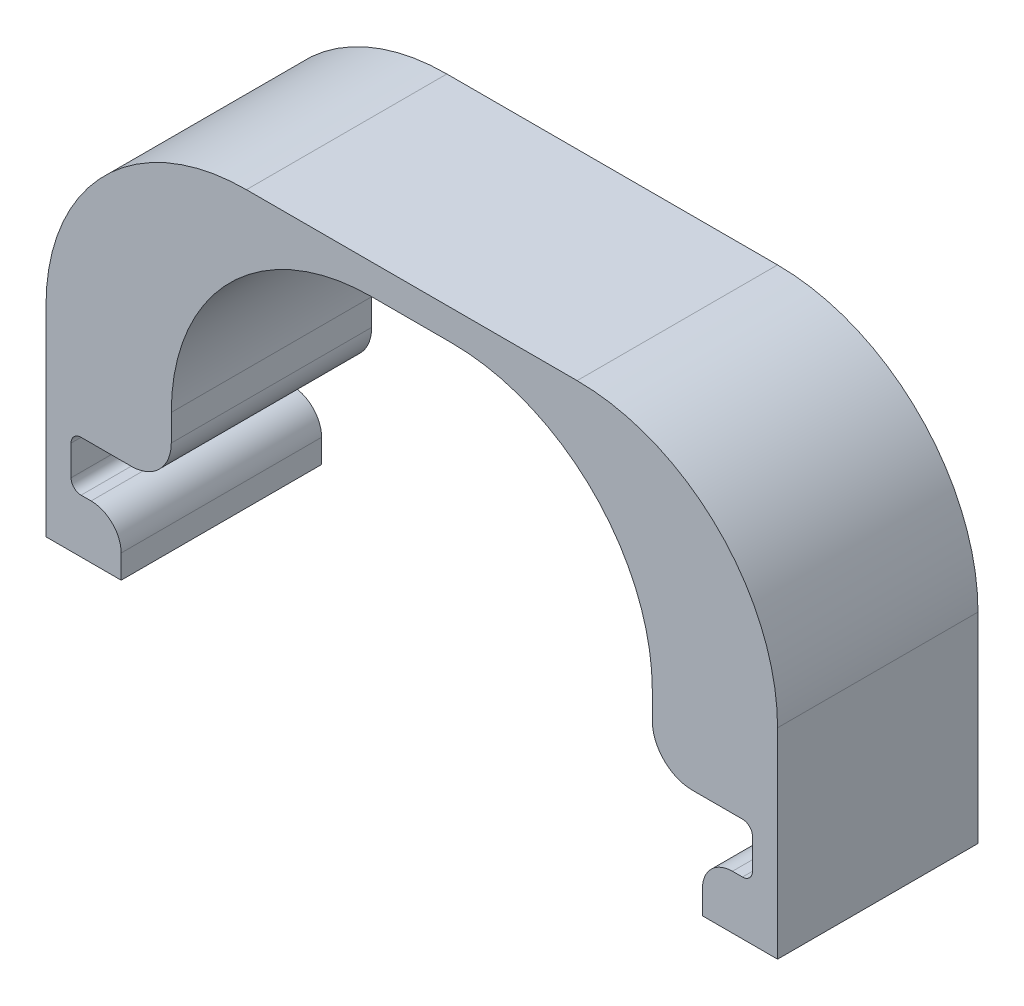
from build123d import *

# Parameters (mm, degrees)
SKETCH1_W           = 73
SKETCH1_H           = 20
BOSS_EXTRUDE1_DEPTH = 40
CUT_EXTRUDE1_DEPTH  = 20
FILLET1_R           = 20
FILLET2_R           = 20


with BuildPart() as part:
    # Sketch1 → Boss-Extrude1 (new body)
    with BuildSketch(Plane(origin=(0, 0, 0), x_dir=(1, 0, 0), z_dir=(0, 1, 0))):
        Rectangle(SKETCH1_W, SKETCH1_H)
    extrude(amount=BOSS_EXTRUDE1_DEPTH)

    # Sketch2 → Cut-Extrude1 (cut)
    with BuildSketch(Plane.XY.offset(10)):
        with BuildLine():
            Line((-29, 0), (-29, 2.352421437))
            ThreePointArc((-29, 2.352421437), (-29.878679656, 4.473741781), (-32, 5.352421437))
            Line((-32, 5.352421437), (-33, 5.352421437))
            ThreePointArc((-33, 5.352421437), (-33.707106781, 5.645314656), (-34, 6.352421437))
            Line((-34, 6.352421437), (-34, 9.352421437))
            ThreePointArc((-34, 9.352421437), (-33.707106781, 10.059528218), (-33, 10.352421437))
            Line((-33, 10.352421437), (-31, 10.352421437))
            Line((-31, 10.352421437), (-28, 10.352421437))
            ThreePointArc((-28, 10.352421437), (-25.171572875, 11.523994313), (-24, 14.352421437))
            Line((-24, 14.352421437), (-24, 37))
            Line((-24, 37), (24, 37))
            Line((24, 37), (24, 14.352421437))
            ThreePointArc((24, 14.352421437), (25.171572875, 11.523994313), (28, 10.352421437))
            Line((28, 10.352421437), (31, 10.352421437))
            Line((31, 10.352421437), (33, 10.352421437))
            ThreePointArc((33, 10.352421437), (33.707106781, 10.059528218), (34, 9.352421437))
            Line((34, 9.352421437), (34, 6.352421437))
            ThreePointArc((34, 6.352421437), (33.707106781, 5.645314656), (33, 5.352421437))
            Line((33, 5.352421437), (32, 5.352421437))
            ThreePointArc((32, 5.352421437), (29.878679656, 4.473741781), (29, 2.352421437))
            Line((29, 2.352421437), (29, 0))
            Line((29, 0), (-29, 0))
        make_face()
    extrude(amount=-CUT_EXTRUDE1_DEPTH, mode=Mode.SUBTRACT)

    # Fillet1
    fillet1_edges = [part.edges().sort_by_distance(p)[0] for p in [
        (36.5, 40, 0),
        (-36.5, 40, 0),
    ]]
    fillet(fillet1_edges, radius=FILLET1_R)

    # Fillet2
    fillet2_edges = [part.edges().sort_by_distance(p)[0] for p in [
        (-24, 37, 0),
        (24, 37, 0),
    ]]
    fillet(fillet2_edges, radius=FILLET2_R)


solid = part.part
